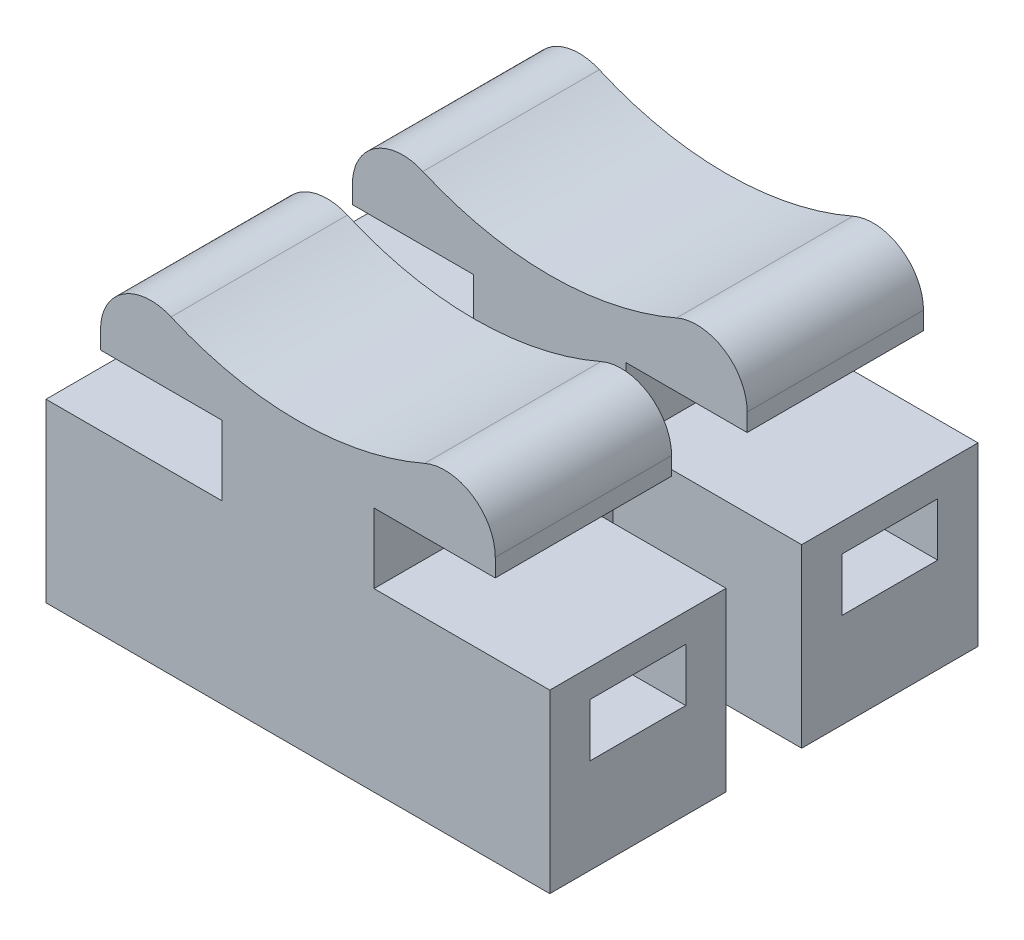
from build123d import *

# Parameters (mm, degrees)
EXTRUDE_1_DEPTH        = 10
EXTRUDE_1_DEPTH_BACK   = 10
SKETCH_1_W             = 7
SKETCH_1_H             = 7
SKETCH_1_W_2           = 3.80020837
SKETCH_1_H_2           = 2.109580793
EXTRUDE_1_2_DEPTH      = 10
EXTRUDE_1_2_DEPTH_BACK = 10
SKETCH_2_W             = 5
SKETCH_2_H             = 3
SKETCH_2_R             = 0.977008115
EXTRUDE_2_DEPTH        = 7
EXTRUDE_3_REACH        = 22.928
FILLET_1_R             = 2
SKETCH_4_W             = 20
SKETCH_4_H             = 3
CUT_EXTRUDE_2_DEPTH    = 20


with BuildPart() as part:
    # 草图1 → 凸台-拉伸1 (new, two sides: drawn at the far end of the back side and taken through both)
    with BuildSketch(Plane(origin=(0, 0, 0), x_dir=(0, 0, -1), z_dir=(1, 0, 0)).offset(-EXTRUDE_1_DEPTH_BACK)):
        with Locations((-5, 3.5)):
            Rectangle(SKETCH_1_W, SKETCH_1_H)
        with Locations((-5, 4.821929683)):
            Rectangle(SKETCH_1_W_2, SKETCH_1_H_2, mode=Mode.SUBTRACT)
    extrude(amount=EXTRUDE_1_DEPTH + EXTRUDE_1_DEPTH_BACK)



with BuildPart() as body_2:
    # 草图1 → Extrude 1 2 (new, two sides: drawn at the far end of the back side and taken through both)
    with BuildSketch(Plane(origin=(0, 0, 0), x_dir=(0, 0, -1), z_dir=(1, 0, 0)).offset(-EXTRUDE_1_2_DEPTH_BACK)):
        with Locations((5, 3.5)):
            Rectangle(SKETCH_1_W, SKETCH_1_H)
        with Locations((5, 4.821929683)):
            Rectangle(SKETCH_1_W_2, SKETCH_1_H_2, mode=Mode.SUBTRACT)
    extrude(amount=EXTRUDE_1_2_DEPTH + EXTRUDE_1_2_DEPTH_BACK)


with BuildPart() as part_1:
    add(part.part)

    add(body_2.part)  # 凸台-拉伸2 merges body 2
    # 草图2 → 凸台-拉伸2 (add)
    with BuildSketch(Plane(origin=(0, 7, 0), x_dir=(1, 0, 0), z_dir=(0, 1, 0))):
        Rectangle(SKETCH_2_W, SKETCH_2_H)
        with Locations(Location((0, 0, 0), (0, 0, 270))):
            Circle(SKETCH_2_R, mode=Mode.SUBTRACT)
    extrude(amount=-EXTRUDE_2_DEPTH)

    # 凸台-拉伸3: up to this face of the body (flat: up to its plane)
    extrude_3_end = Plane(part_1.part.faces().sort_by_distance((0, 3.5, -8.5))[0])
    # 草图3 → 凸台-拉伸3 (add, up to the picked face)
    with BuildSketch(Plane.XY.offset(8.5), mode=Mode.PRIVATE) as extrude_3_sk1:
        with BuildLine():
            Line((-7.835690173, 14), (-7.835690173, 9.772160356))
            Line((-7.835690173, 9.772160356), (-3.020853064, 9.772160356))
            Line((-3.020853064, 9.772160356), (-3.020853064, 7))
            Line((-3.020853064, 7), (3.020853064, 7))
            Line((3.020853064, 7), (3.020853064, 9.772160356))
            Line((3.020853064, 9.772160356), (7.835690173, 9.772160356))
            Line((7.835690173, 9.772160356), (7.835690173, 14))
            ThreePointArc((7.835690173, 14), (0, 11.260367321), (-7.835690173, 14))
        make_face()
    extrude_3_tool1 = split(extrude(extrude_3_sk1.sketch, amount=-EXTRUDE_3_REACH, mode=Mode.PRIVATE), bisect_by=extrude_3_end, keep=Keep.BOTH, mode=Mode.PRIVATE)
    add(extrude_3_tool1.solids().sort_by(Axis((0, 10.244558, 8.5), (0, 0, -1)))[0])

    # 圆角1
    fillet_1_edges = [part_1.edges().sort_by_distance(p)[0] for p in [
        (7.835690173, 14, 0),
        (-7.835690173, 14, 0),
    ]]
    fillet(fillet_1_edges, radius=FILLET_1_R)

    # 草图4 → 切除-拉伸2 (cut)
    with BuildSketch(Plane(origin=(0, 7, 0), x_dir=(1, 0, 0), z_dir=(0, 1, 0))):
        Rectangle(SKETCH_4_W, SKETCH_4_H)
    extrude(amount=CUT_EXTRUDE_2_DEPTH, mode=Mode.SUBTRACT)


solid = part_1.part
